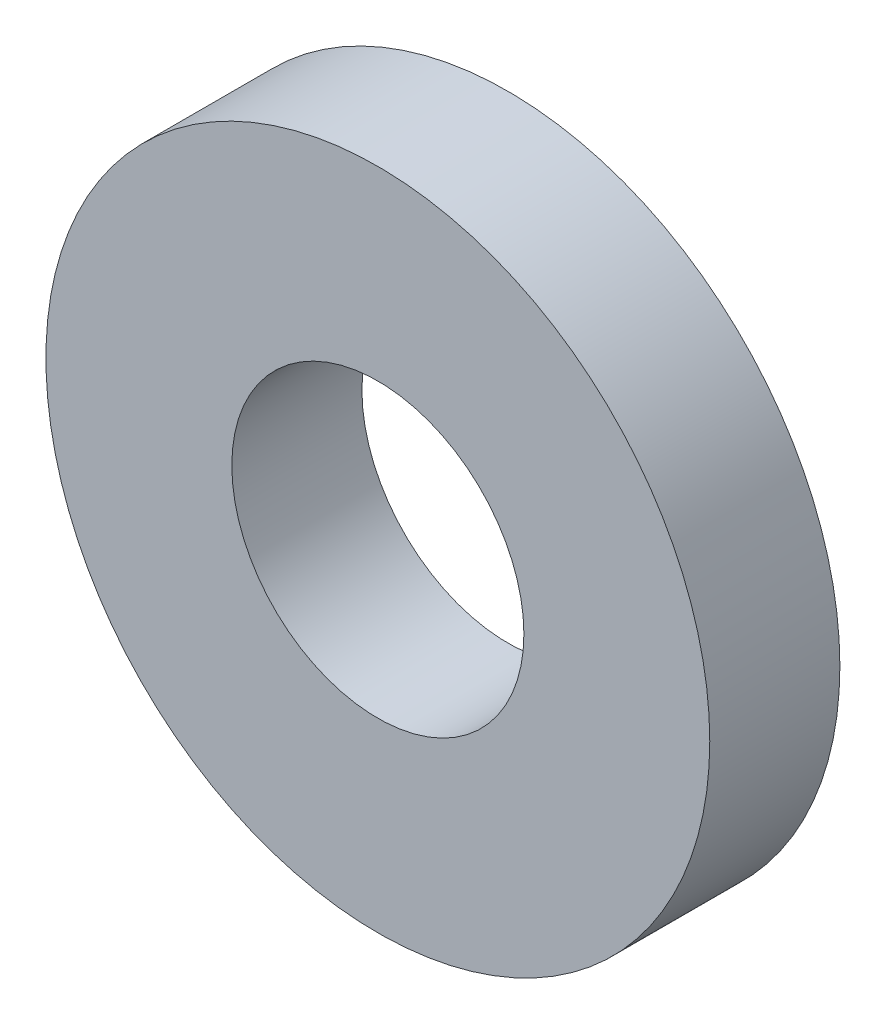
from build123d import *

# Parameters (mm, degrees)
SKETCH1_R           = 7.9375
SKETCH1_R_2         = 3.4925
BOSS_EXTRUDE1_DEPTH = 3.1115


with BuildPart() as part:
    # Sketch1 → Boss-Extrude1 (new body)
    with BuildSketch(Plane.XY):
        Circle(SKETCH1_R)
        Circle(SKETCH1_R_2, mode=Mode.SUBTRACT)
    extrude(amount=BOSS_EXTRUDE1_DEPTH)


solid = part.part
